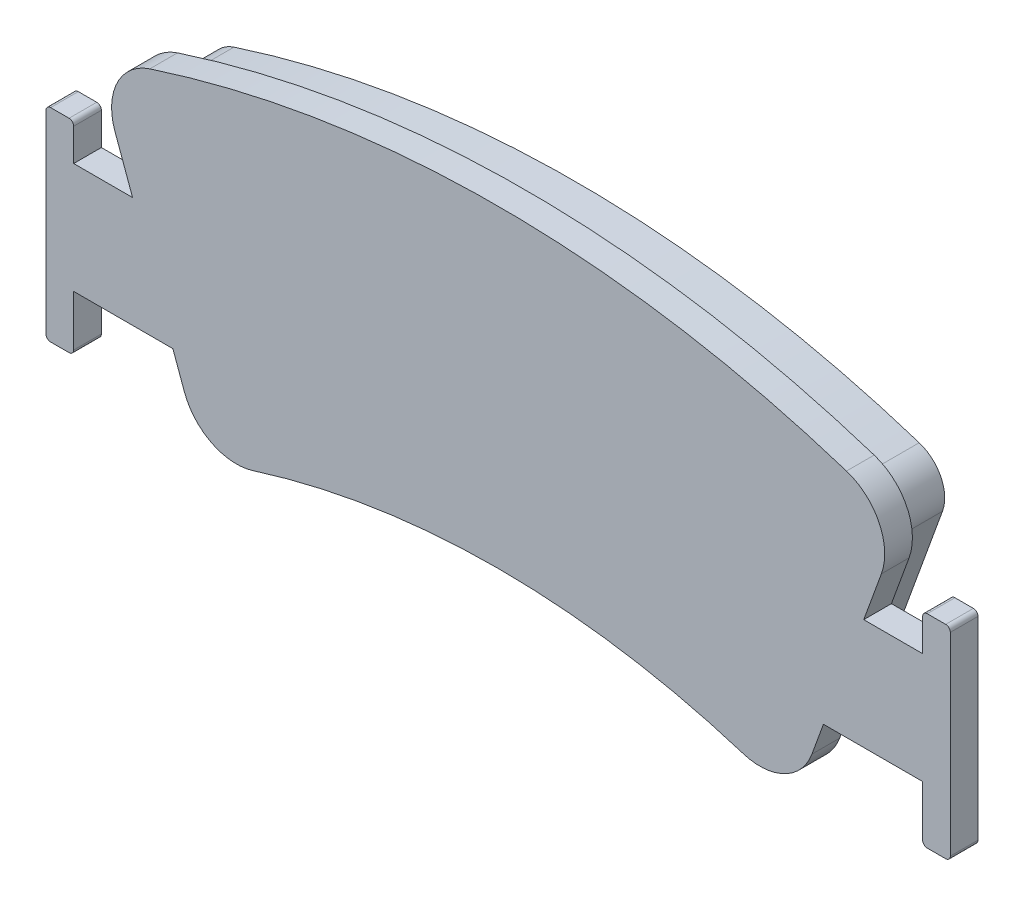
from build123d import *
from OCP.BRepFilletAPI import BRepFilletAPI_MakeChamfer

# Parameters (mm, degrees)
DODANIE_WYCI_GNI_CIE1_DEPTH = 6.5
DODANIE_WYCI_GNI_CIE2_DEPTH = 3
SFAZOWANIE1_SIZE            = 1
SFAZOWANIE1_SIZE2           = 2.747477419


with BuildPart() as part:
    # Szkic2 → Dodanie-wyciągnięcie1 (new body)
    with BuildSketch(Plane.XY):
        with BuildLine():
            Line((-39.650742014, 108.939518347), (-32.120772186, 88.251096277))
            ThreePointArc((-32.120772186, 88.251096277), (-30.12924195, 86.030742386), (-27.155108014, 85.805594857))
            ThreePointArc((-27.155108014, 85.805594857), (-13.738567299, 88.945217795), (0, 90))
            Line((0, 90), (0, 120))
            ThreePointArc((0, 120), (-18.796846712, 118.518684408), (-37.129625721, 114.111309228))
            ThreePointArc((-37.129625721, 114.111309228), (-39.48751323, 112.060333895), (-39.650742014, 108.939518347))
        make_face()
    dodanie_wyci_gni_cie1 = extrude(amount=DODANIE_WYCI_GNI_CIE1_DEPTH)

    # Szkic3 → Dodanie-wyciągnięcie2 (add)
    with BuildSketch(Plane.XY.offset(6.5)):
        with BuildLine():
            Line((-46, 91), (-35.249646863, 91))
            Line((-35.249646863, 91), (-34.000157428, 87.567055991))
            ThreePointArc((-34.000157428, 87.567055991), (-31.012862074, 84.236525153), (-26.551661169, 83.89880386))
            ThreePointArc((-26.551661169, 83.89880386), (-13.433265804, 86.968657399), (0, 88))
            Line((0, 88), (0, 90))
            ThreePointArc((0, 90), (-13.738567299, 88.945217795), (-27.155108014, 85.805594857))
            ThreePointArc((-27.155108014, 85.805594857), (-30.12924195, 86.030742386), (-32.120772186, 88.251096277))
            Line((-32.120772186, 88.251096277), (-39.650742014, 108.939518347))
            ThreePointArc((-39.650742014, 108.939518347), (-39.48751323, 112.060333895), (-37.129625721, 114.111309228))
            ThreePointArc((-37.129625721, 114.111309228), (-18.796846712, 118.518684408), (0, 120))
            Line((0, 120), (0, 122))
            ThreePointArc((0, 122), (-19.11012749, 120.493995814), (-37.748452817, 116.013164382))
            ThreePointArc((-37.748452817, 116.013164382), (-41.285284079, 112.936701382), (-41.530127255, 108.255478061))
            Line((-41.530127255, 108.255478061), (-39.617289674, 103))
            Line((-39.617289674, 103), (-46, 103))
            Line((-46, 103), (-46, 106.5))
            ThreePointArc((-46, 106.5), (-46.146446609, 106.853553391), (-46.5, 107))
            Line((-46.5, 107), (-48.5, 107))
            ThreePointArc((-48.5, 107), (-48.853553391, 106.853553391), (-49, 106.5))
            Line((-49, 106.5), (-49, 103))
            Line((-49, 103), (-49, 85.5))
            ThreePointArc((-49, 85.5), (-48.853553391, 85.146446609), (-48.5, 85))
            Line((-48.5, 85), (-46.5, 85))
            ThreePointArc((-46.5, 85), (-46.146446609, 85.146446609), (-46, 85.5))
            Line((-46, 85.5), (-46, 91))
        make_face()
        with BuildLine():
            ThreePointArc((-27.155108014, 85.805594857), (-13.738567299, 88.945217795), (0, 90))
            Line((0, 90), (0, 120))
            ThreePointArc((0, 120), (-18.796846712, 118.518684408), (-37.129625721, 114.111309228))
            ThreePointArc((-37.129625721, 114.111309228), (-39.48751323, 112.060333895), (-39.650742014, 108.939518347))
            Line((-39.650742014, 108.939518347), (-32.120772186, 88.251096277))
            ThreePointArc((-32.120772186, 88.251096277), (-30.12924195, 86.030742386), (-27.155108014, 85.805594857))
        make_face()
    dodanie_wyci_gni_cie2 = extrude(amount=DODANIE_WYCI_GNI_CIE2_DEPTH)

    # Lustro1: Dodanie-wyciągnięcie1, Dodanie-wyciągnięcie2 across plane
    add(dodanie_wyci_gni_cie1.mirror(Plane(origin=(0, 0, 0), x_dir=(0, 0, 1), z_dir=(1, 0, 0))))
    add(dodanie_wyci_gni_cie2.mirror(Plane(origin=(0, 0, 0), x_dir=(0, 0, 1), z_dir=(1, 0, 0))))

    # Sfazowanie1: one chamfer whose edges measure the first distance from different faces: ONE call of the kernel's chamfer builder (chamfer() names one face for all edges)
    sfazowanie1_edges_1 = [part.edges().sort_by_distance(p)[0] for p in [
        (-39.48751323, 112.060333895, 0),
    ]]
    sfazowanie1_side_1 = [part.faces().sort_by_distance(p)[0] for p in [
        (-39.48751323, 112.060333895, 3.25),
    ]]
    sfazowanie1_edges_2 = [part.edges().sort_by_distance(p)[0] for p in [
        (0, 120, 0),
    ]]
    sfazowanie1_side_2 = [part.faces().sort_by_distance(p)[0] for p in [
        (0, 120, 3.25),
    ]]
    sfazowanie1_edges_3 = [part.edges().sort_by_distance(p)[0] for p in [
        (30.12924195, 86.030742386, 0),
    ]]
    sfazowanie1_side_3 = [part.faces().sort_by_distance(p)[0] for p in [
        (30.12924195, 86.030742386, 3.25),
    ]]
    sfazowanie1_edges_4 = [part.edges().sort_by_distance(p)[0] for p in [
        (35.8857571, 98.595307312, 0),
    ]]
    sfazowanie1_side_4 = [part.faces().sort_by_distance(p)[0] for p in [
        (35.8857571, 98.595307312, 3.25),
    ]]
    sfazowanie1_edges_5 = [part.edges().sort_by_distance(p)[0] for p in [
        (39.48751323, 112.060333895, 0),
    ]]
    sfazowanie1_side_5 = [part.faces().sort_by_distance(p)[0] for p in [
        (39.48751323, 112.060333895, 3.25),
    ]]
    sfazowanie1_edges_6 = [part.edges().sort_by_distance(p)[0] for p in [
        (0, 90, 0),
    ]]
    sfazowanie1_side_6 = [part.faces().sort_by_distance(p)[0] for p in [
        (0, 90, 3.25),
    ]]
    sfazowanie1_edges_7 = [part.edges().sort_by_distance(p)[0] for p in [
        (-30.12924195, 86.030742386, 0),
    ]]
    sfazowanie1_side_7 = [part.faces().sort_by_distance(p)[0] for p in [
        (-30.12924195, 86.030742386, 3.25),
    ]]
    sfazowanie1_edges_8 = [part.edges().sort_by_distance(p)[0] for p in [
        (-35.8857571, 98.595307312, 0),
    ]]
    sfazowanie1_side_8 = [part.faces().sort_by_distance(p)[0] for p in [
        (-35.8857571, 98.595307312, 3.25),
    ]]
    sfazowanie1 = BRepFilletAPI_MakeChamfer(part.part.solid().wrapped)
    for e in sfazowanie1_edges_1:
        sfazowanie1.Add(SFAZOWANIE1_SIZE, SFAZOWANIE1_SIZE2, e.wrapped, sfazowanie1_side_1[0].wrapped)  # the first distance lies on this face
    for e in sfazowanie1_edges_2:
        sfazowanie1.Add(SFAZOWANIE1_SIZE, SFAZOWANIE1_SIZE2, e.wrapped, sfazowanie1_side_2[0].wrapped)  # the first distance lies on this face
    for e in sfazowanie1_edges_3:
        sfazowanie1.Add(SFAZOWANIE1_SIZE, SFAZOWANIE1_SIZE2, e.wrapped, sfazowanie1_side_3[0].wrapped)  # the first distance lies on this face
    for e in sfazowanie1_edges_4:
        sfazowanie1.Add(SFAZOWANIE1_SIZE, SFAZOWANIE1_SIZE2, e.wrapped, sfazowanie1_side_4[0].wrapped)  # the first distance lies on this face
    for e in sfazowanie1_edges_5:
        sfazowanie1.Add(SFAZOWANIE1_SIZE, SFAZOWANIE1_SIZE2, e.wrapped, sfazowanie1_side_5[0].wrapped)  # the first distance lies on this face
    for e in sfazowanie1_edges_6:
        sfazowanie1.Add(SFAZOWANIE1_SIZE, SFAZOWANIE1_SIZE2, e.wrapped, sfazowanie1_side_6[0].wrapped)  # the first distance lies on this face
    for e in sfazowanie1_edges_7:
        sfazowanie1.Add(SFAZOWANIE1_SIZE, SFAZOWANIE1_SIZE2, e.wrapped, sfazowanie1_side_7[0].wrapped)  # the first distance lies on this face
    for e in sfazowanie1_edges_8:
        sfazowanie1.Add(SFAZOWANIE1_SIZE, SFAZOWANIE1_SIZE2, e.wrapped, sfazowanie1_side_8[0].wrapped)  # the first distance lies on this face
    add(Compound.cast(sfazowanie1.Shape()), mode=Mode.REPLACE)


solid = part.part
